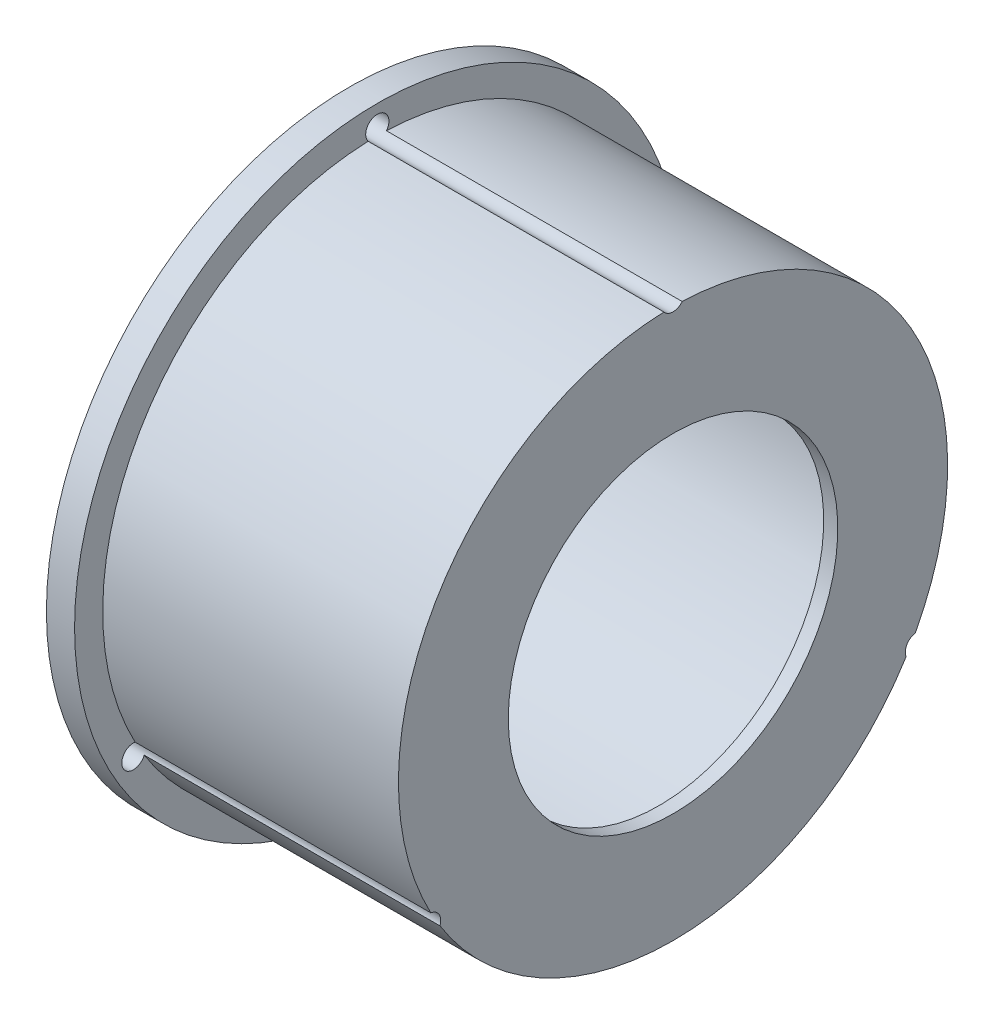
from build123d import *

# Parameters (mm, degrees)
AXIAL_HOLES_DEPTH      = 192.606080279
AXIAL_HOLES_DEPTH_BACK = 192.606080279
SKETCH2_R              = 1.65


with BuildPart() as part:
    # Axial profile (mm) → Full revolution (revolve)
    with BuildSketch(Plane.XY, mode=Mode.PRIVATE) as full_revolution_sk:
        Polygon((135.7, 36.4), (179.7, 36.4), (179.7, 23.4), (181.7, 23.4), (181.7, 39), (139.7, 39), (139.7, 43), (135.7, 43), align=None)
    revolve(full_revolution_sk.sketch.rotate(Axis((-110, 0, 0), (1, 0, 0)), 90), axis=Axis((-110, 0, 0), (1, 0, 0)))

    # Sketch2 → Axial holes (cut, two sides: drawn at the far end of the back side and taken through both)
    with BuildSketch(Plane(origin=(0, 0, 0), x_dir=(0, 0, -1), z_dir=(1, 0, 0)).offset(-AXIAL_HOLES_DEPTH_BACK)):
        with Locations(Location((0, 40, 0), (0, 0, 218.251159994))):
            Circle(SKETCH2_R)
        with Locations(Location((-34.641016151, -20, 0), (0, 0, 81.748840006))):
            Circle(SKETCH2_R)
        with Locations(Location((34.641016151, -20, 0), (0, 0, 201.748840006))):
            Circle(SKETCH2_R)
    extrude(amount=AXIAL_HOLES_DEPTH + AXIAL_HOLES_DEPTH_BACK, mode=Mode.SUBTRACT)


solid = part.part
